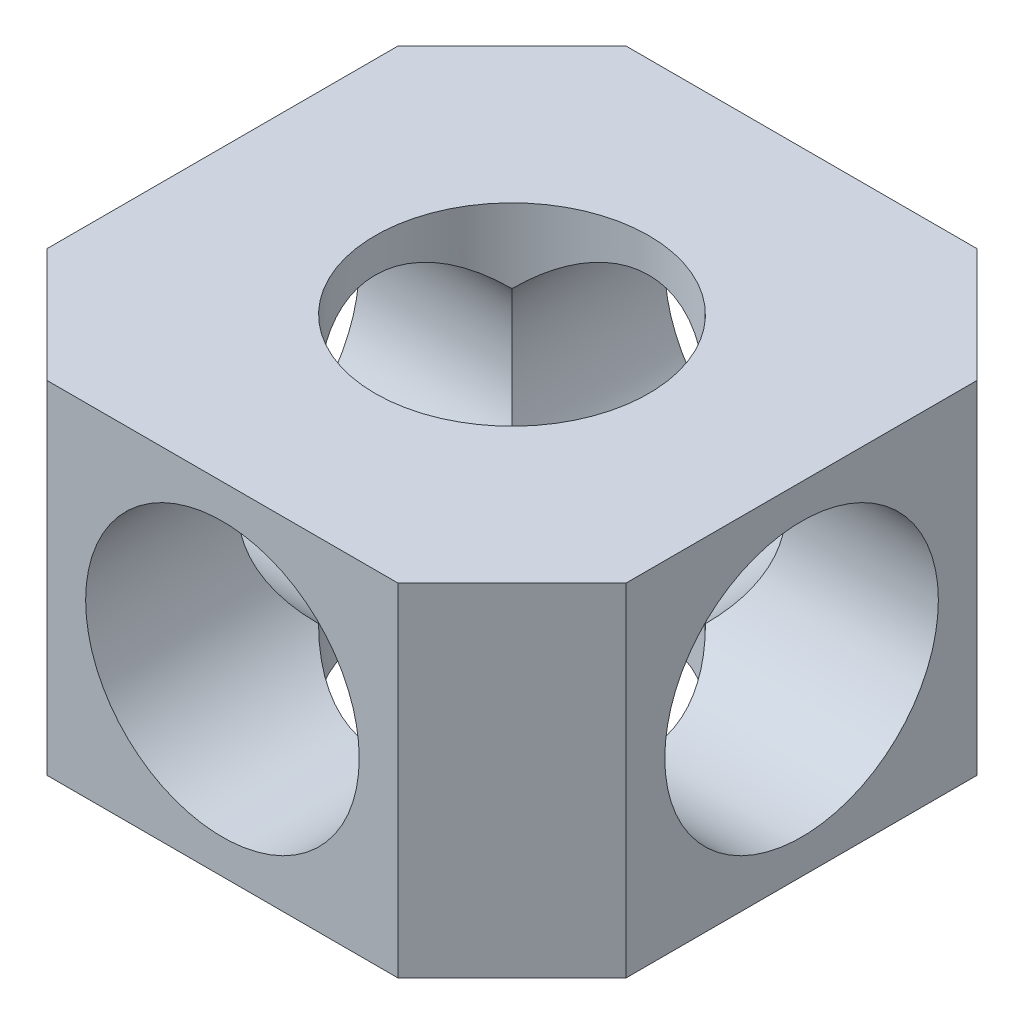
from build123d import *

# Parameters (mm, degrees)
SKETCH1_W           = 25.4
SKETCH1_H           = 25.4
BOSS_EXTRUDE1_DEPTH = 7.5
CHAMFER1_SIZE       = 5
SKETCH2_R           = 6
CUT_EXTRUDE1_DEPTH  = 24.400427347
SKETCH3_R           = 6
CUT_EXTRUDE2_DEPTH  = 30.37175514
CIRPATTERN7_COUNT   = 2
CIRPATTERN7_ANGLE   = 90


with BuildPart() as part:
    # Sketch1 → Boss-Extrude1 (new, symmetric)
    with BuildSketch(Plane(origin=(0, 0, 0), x_dir=(1, 0, 0), z_dir=(0, 1, 0))):
        Rectangle(SKETCH1_W, SKETCH1_H)
    extrude(amount=BOSS_EXTRUDE1_DEPTH, both=True)

    # Chamfer1
    chamfer1_edges = [part.edges().sort_by_distance(p)[0] for p in [
        (12.7, 0, 12.7),
        (-12.7, 0, 12.7),
        (-12.7, 0, -12.7),
        (12.7, 0, -12.7),
    ]]
    chamfer(chamfer1_edges, length=CHAMFER1_SIZE)

    # Sketch2 → Cut-Extrude1 (cut, through all)
    with BuildSketch(Plane(origin=(0, 7.5, 0), x_dir=(1, 0, 0), z_dir=(0, 1, 0))):
        with Locations(Location((0, 0, 0), (0, 0, 270))):
            Circle(SKETCH2_R)
    extrude(amount=-CUT_EXTRUDE1_DEPTH, mode=Mode.SUBTRACT)

    # Sketch3 → Cut-Extrude2 (cut, through all)
    with BuildSketch(Plane.ZY.offset(12.7)):
        Circle(SKETCH3_R)
    cut_extrude2 = extrude(amount=-CUT_EXTRUDE2_DEPTH, mode=Mode.SUBTRACT)

    # CirPattern7: Cut-Extrude2 ×2 about axis
    cirpattern7_axis = Axis((0, -7.5, 0), (0, 1, 0))
    for i in range(1, CIRPATTERN7_COUNT):
        add(cut_extrude2.rotate(cirpattern7_axis, i * CIRPATTERN7_ANGLE / (CIRPATTERN7_COUNT - 1)), mode=Mode.SUBTRACT)


solid = part.part
